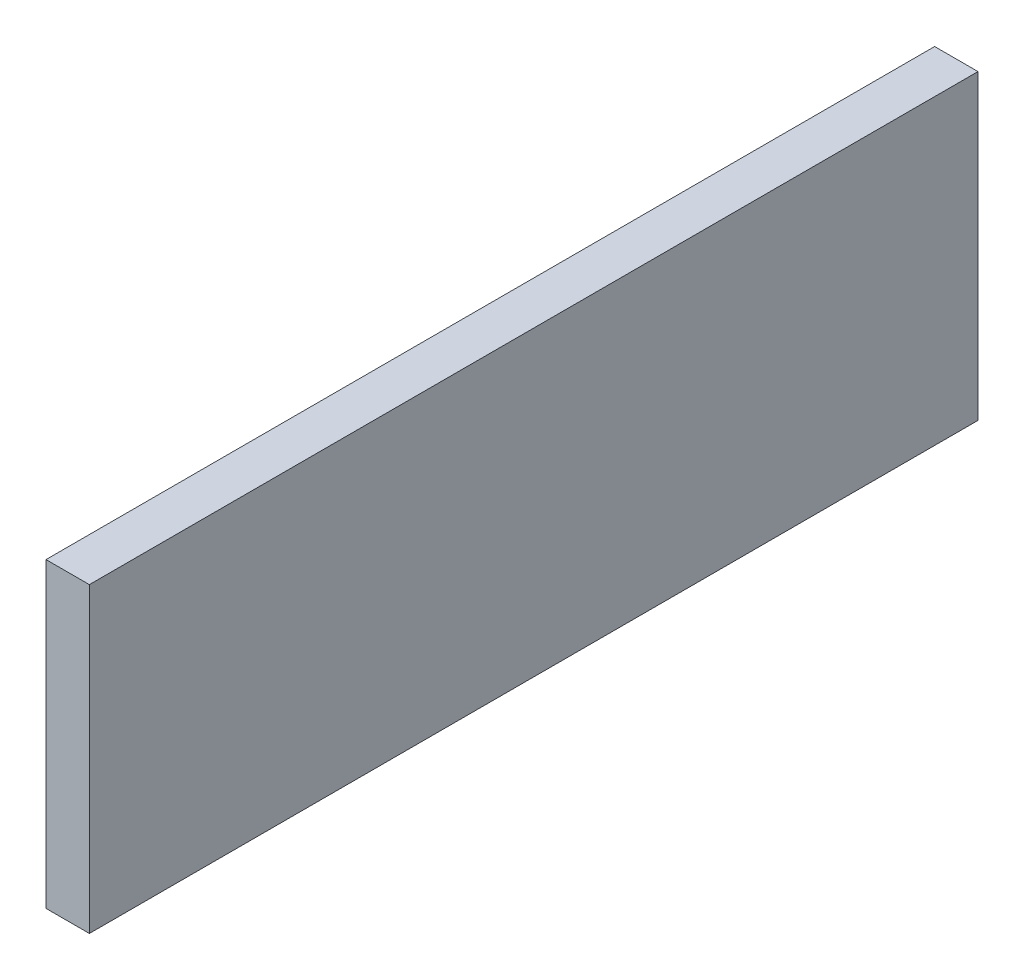
from build123d import *

# Parameters (mm, degrees)
SKETCH1_W           = 250
SKETCH1_H           = 85
BOSS_EXTRUDE1_DEPTH = 12.2


with BuildPart() as part:
    # Sketch1 → Boss-Extrude1 (new body)
    with BuildSketch(Plane(origin=(0, 0, 0), x_dir=(0, 0, -1), z_dir=(1, 0, 0))):
        Rectangle(SKETCH1_W, SKETCH1_H)
    extrude(amount=BOSS_EXTRUDE1_DEPTH)


solid = part.part
